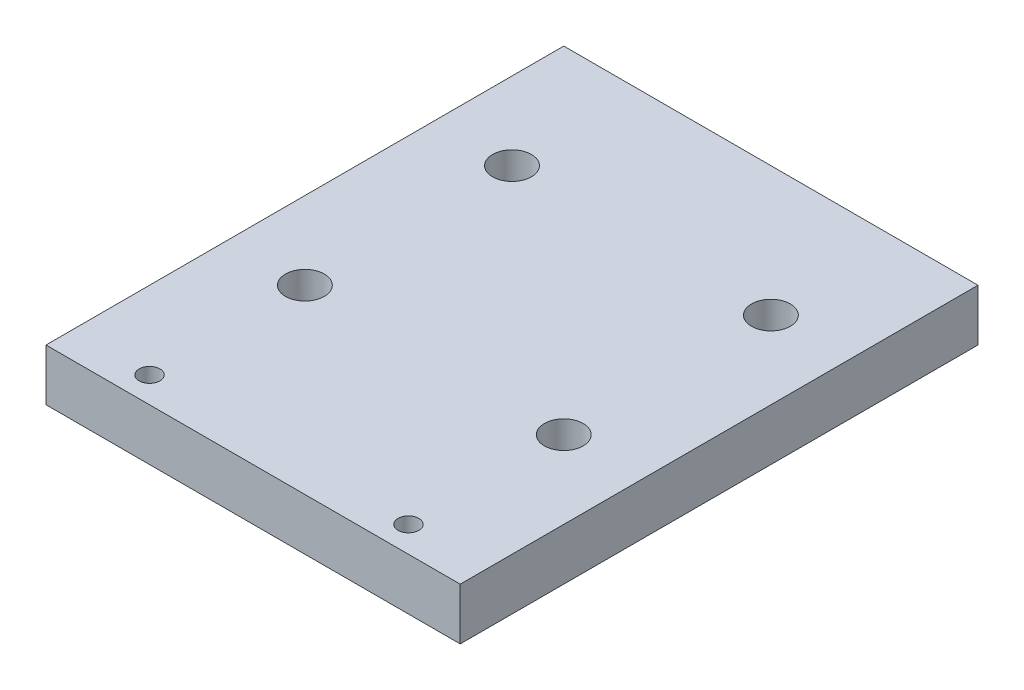
from build123d import *

# Parameters (mm, degrees)
SKETCH1_W                                          = 101.6
SKETCH1_H                                          = 127
BOSS_EXTRUDE1_DEPTH                                = 12.7
CSK_FOR_10_FLAT_HEAD_MACHINE_SCREW_100_D           = 5.1054
CSK_FOR_10_FLAT_HEAD_MACHINE_SCREW_100_DEPTH       = 12.7
CSK_FOR_10_FLAT_HEAD_MACHINE_SCREW_100_CSINK_D     = 9.779
CSK_FOR_10_FLAT_HEAD_MACHINE_SCREW_100_CSINK_ANGLE = 100
CSK_FOR_10_FLAT_HEAD_MACHINE_SCREW_100_TIP         = 1.533816902
F_3_8_0_375_DIAMETER_HOLE1_D                       = 9.525
F_3_8_0_375_DIAMETER_HOLE1_DEPTH                   = 25.4
F_3_8_0_375_DIAMETER_HOLE1_TIP                     = 2.861598698


with BuildPart() as part:
    # Sketch1 → Boss-Extrude1 (new body)
    with BuildSketch(Plane(origin=(0, 0, 0), x_dir=(1, 0, 0), z_dir=(0, 1, 0))):
        Rectangle(SKETCH1_W, SKETCH1_H)
    extrude(amount=BOSS_EXTRUDE1_DEPTH)

    # CSK for #10 Flat Head Machine Screw (100)1
    with Locations(Plane(origin=(0, 0, 0), x_dir=(-1, 0, 0), z_dir=(0, -1, 0))):
        with Locations((31.75, -57.15), (-31.75, -57.15)):
            CounterSinkHole(CSK_FOR_10_FLAT_HEAD_MACHINE_SCREW_100_D / 2, CSK_FOR_10_FLAT_HEAD_MACHINE_SCREW_100_CSINK_D / 2, depth=CSK_FOR_10_FLAT_HEAD_MACHINE_SCREW_100_DEPTH, counter_sink_angle=CSK_FOR_10_FLAT_HEAD_MACHINE_SCREW_100_CSINK_ANGLE)
            with Locations((0, 0, -(CSK_FOR_10_FLAT_HEAD_MACHINE_SCREW_100_DEPTH + CSK_FOR_10_FLAT_HEAD_MACHINE_SCREW_100_TIP / 2))):  # 118° drill point
                Cone(0, CSK_FOR_10_FLAT_HEAD_MACHINE_SCREW_100_D / 2, CSK_FOR_10_FLAT_HEAD_MACHINE_SCREW_100_TIP, mode=Mode.SUBTRACT)

    # 3/8 (0.375) Diameter Hole1
    with Locations(Plane(origin=(0, 12.7, 0), x_dir=(1, 0, 0), z_dir=(0, 1, 0))):
        with Locations((-31.75, 31.75), (31.75, 31.75), (-31.75, -19.05), (31.75, -19.05)):
            Hole(F_3_8_0_375_DIAMETER_HOLE1_D / 2, depth=F_3_8_0_375_DIAMETER_HOLE1_DEPTH)
            with Locations((0, 0, -(F_3_8_0_375_DIAMETER_HOLE1_DEPTH + F_3_8_0_375_DIAMETER_HOLE1_TIP / 2))):  # 118° drill point
                Cone(0, F_3_8_0_375_DIAMETER_HOLE1_D / 2, F_3_8_0_375_DIAMETER_HOLE1_TIP, mode=Mode.SUBTRACT)


solid = part.part
